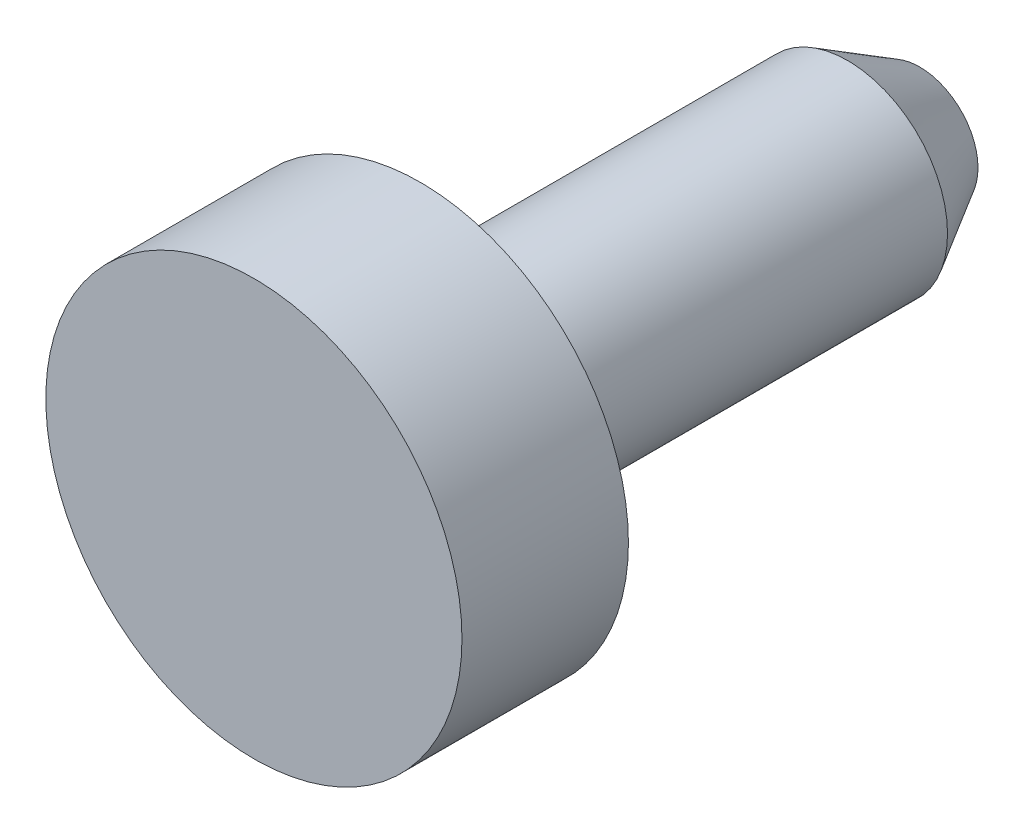
from build123d import *

# Parameters (mm, degrees)
CROQUIS1_R              = 2.5
SALIENTE_EXTRUIR1_DEPTH = 2
CROQUIS2_R              = 1.2
SALIENTE_EXTRUIR2_DEPTH = 6
CHAFL_N1_SIZE           = 0.5
CHAFL_N1_SIZE2          = 0.866025404


with BuildPart() as part:
    # Croquis1 → Saliente-Extruir1 (new body)
    with BuildSketch(Plane.XY):
        Circle(CROQUIS1_R)
    extrude(amount=SALIENTE_EXTRUIR1_DEPTH)

    # Croquis2 → Saliente-Extruir2 (add)
    with BuildSketch(Plane.XY):
        Circle(CROQUIS2_R)
    extrude(amount=-SALIENTE_EXTRUIR2_DEPTH)

    # Chaflán1
    chafl_n1_edges = [part.edges().sort_by_distance(p)[0] for p in [
        (-1.2, 0, -6),
    ]]
    chafl_n1_side = [part.faces().sort_by_distance(p)[0] for p in [
        (0, 0, -6),
    ]]
    chamfer(chafl_n1_edges, length=CHAFL_N1_SIZE, length2=CHAFL_N1_SIZE2, reference=chafl_n1_side[0])


solid = part.part
